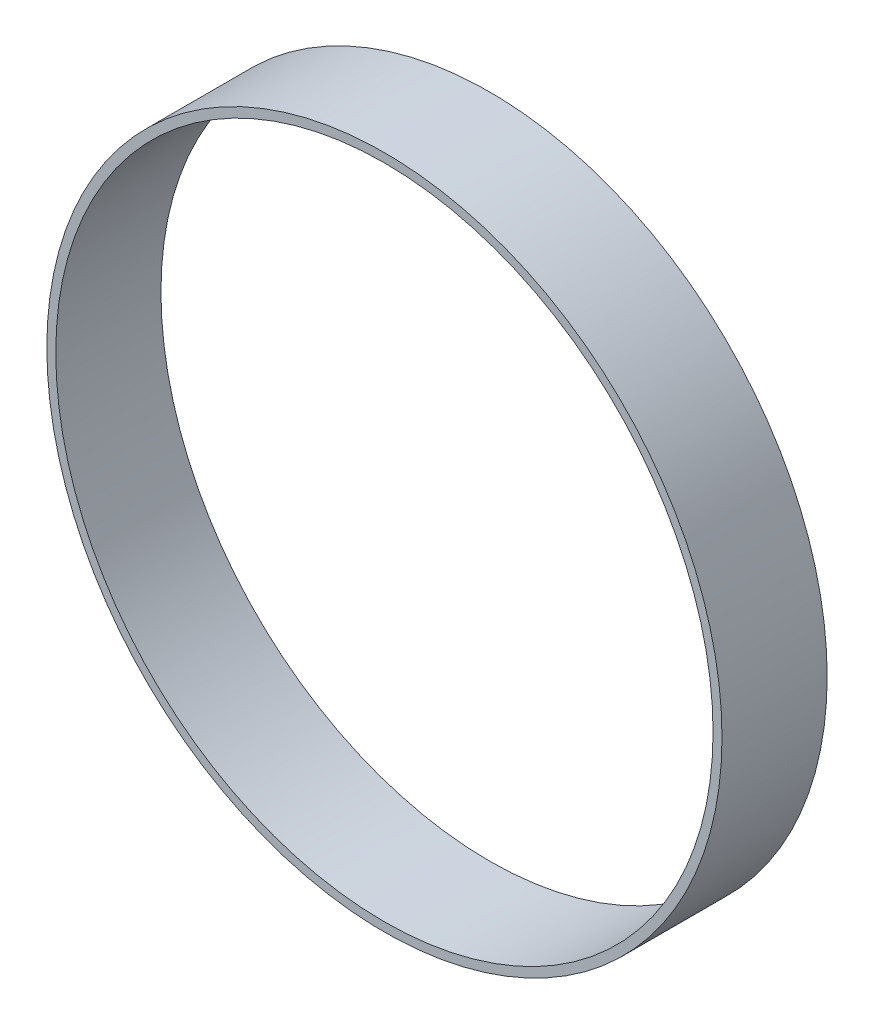
from build123d import *

# Parameters (mm, degrees)
SKETCH1_R           = 64.2
SKETCH1_R_2         = 62.5
BOSS_EXTRUDE1_DEPTH = 20


with BuildPart() as part:
    # Sketch1 → Boss-Extrude1 (new body)
    with BuildSketch(Plane.XY):
        Circle(SKETCH1_R)
        Circle(SKETCH1_R_2, mode=Mode.SUBTRACT)
    extrude(amount=BOSS_EXTRUDE1_DEPTH)


solid = part.part
